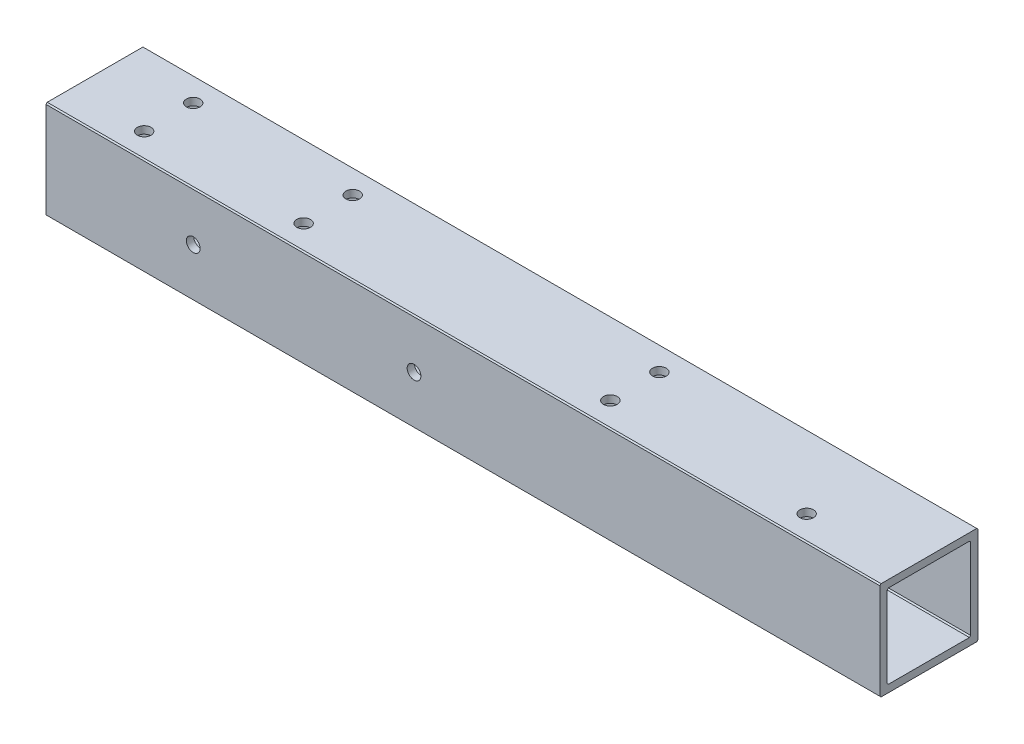
from build123d import *

# Parameters (mm, degrees)
SKETCH1_W                      = 339.85
SKETCH1_H                      = 40
BOSS_EXTRUDE1_DEPTH            = 40
SKETCH2_W                      = 34
SKETCH2_H                      = 34
CUT_EXTRUDE1_DEPTH             = 395.033022093
F_5_6_5_6_DIAMETER_HOLE1_D     = 5.6
F_5_6_5_6_DIAMETER_HOLE1_DEPTH = 3
F_5_6_5_6_DIAMETER_HOLE2_D     = 5.6
F_5_6_5_6_DIAMETER_HOLE2_DEPTH = 3
F_5_6_5_6_DIAMETER_HOLE3_D     = 5.6
F_5_6_5_6_DIAMETER_HOLE4_D     = 5.6
F_5_6_5_6_DIAMETER_HOLE4_DEPTH = 40
CHAMFER1_SIZE                  = 0.5


with BuildPart() as part:
    # Sketch1 → Boss-Extrude1 (new body)
    with BuildSketch(Plane(origin=(0, 142, 0), x_dir=(1, 0, 0), z_dir=(0, 1, 0))):
        with Locations((-80.075, -120)):
            Rectangle(SKETCH1_W, SKETCH1_H)
    extrude(amount=-BOSS_EXTRUDE1_DEPTH)

    # Sketch2 → Cut-Extrude1 (cut, through all)
    with BuildSketch(Plane.ZY.offset(250)):
        with Locations((120, 122)):
            Rectangle(SKETCH2_W, SKETCH2_H)
    extrude(amount=-CUT_EXTRUDE1_DEPTH, mode=Mode.SUBTRACT)

    # Ø5.6 (5.6) Diameter Hole1
    with Locations(Plane(origin=(0, 105, 0), x_dir=(1, 0, 0), z_dir=(0, 1, 0))):
        with Locations((50, -130), (-30, -130), (-30, -110), (-155, -130), (-220, -130), (-155, -110), (-220, -110)):
            Hole(F_5_6_5_6_DIAMETER_HOLE1_D / 2, depth=F_5_6_5_6_DIAMETER_HOLE1_DEPTH)

    # Ø5.6 (5.6) Diameter Hole2
    with Locations(Plane(origin=(0, 0, 100), x_dir=(-1, 0, 0), z_dir=(0, 0, -1))):
        with Locations((100, 122), (190, 122)):
            Hole(F_5_6_5_6_DIAMETER_HOLE2_D / 2, depth=F_5_6_5_6_DIAMETER_HOLE2_DEPTH)

    # Ø5.6 (5.6) Diameter Hole3 (through all)
    with Locations(Plane(origin=(0, 0, 137), x_dir=(-1, 0, 0), z_dir=(0, 0, -1))):
        with Locations((100, 122), (190, 122)):
            Hole(F_5_6_5_6_DIAMETER_HOLE3_D / 2)

    # Ø5.6 (5.6) Diameter Hole4
    with Locations(Plane(origin=(0, 142, 0), x_dir=(1, 0, 0), z_dir=(0, 1, 0))):
        with Locations((50, -130), (-30, -130), (-30, -110), (-155, -130), (-220, -130), (-155, -110), (-220, -110)):
            Hole(F_5_6_5_6_DIAMETER_HOLE4_D / 2, depth=F_5_6_5_6_DIAMETER_HOLE4_DEPTH)

    # Chamfer1
    chamfer1_edges = [part.edges().sort_by_distance(p)[0] for p in [
        (-80.075, 102, 100),
        (-80.075, 105, 103),
        (-80.075, 139, 103),
        (-80.075, 139, 137),
        (-80.075, 105, 137),
        (-80.075, 102, 140),
        (-80.075, 142, 100),
        (-80.075, 142, 140),
    ]]
    chamfer(chamfer1_edges, length=CHAMFER1_SIZE)


solid = part.part
